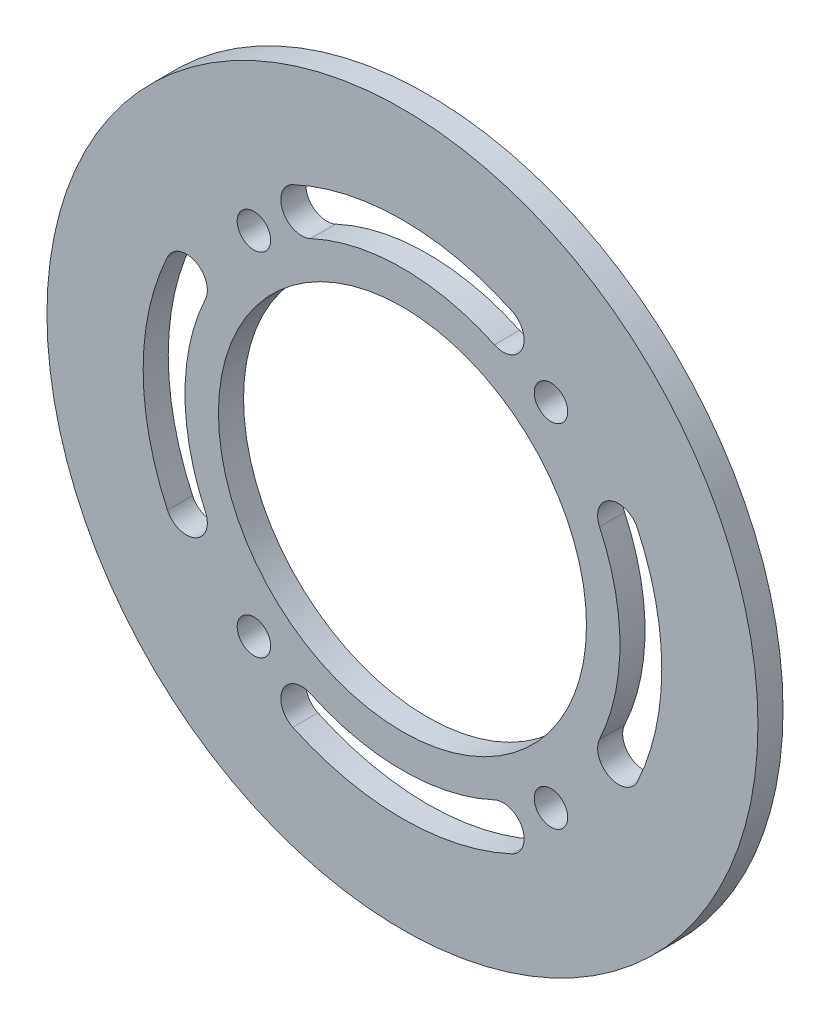
from build123d import *

# Parameters (mm, degrees)
SKETCH_1_R          = 24
SKETCH_1_R_2        = 22
EXTRUDE_1_DEPTH     = 20
SKETCH_2_R          = 42.5
SKETCH_2_R_2        = 22
EXTRUDE_2_DEPTH     = 3
CUT_EXTRUDE_3_DEPTH = 5
SKETCH_12_R         = 24
CUT_EXTRUDE_4_DEPTH = 20
SKETCH_13_R         = 2
CUT_EXTRUDE_7_DEPTH = 30


with BuildPart() as part:
    # 草图1 → 凸台-拉伸1 (new body)
    with BuildSketch(Plane.XY):
        Circle(SKETCH_1_R)
        Circle(SKETCH_1_R_2, mode=Mode.SUBTRACT)
    extrude(amount=EXTRUDE_1_DEPTH)

    # 草图2 → 凸台-拉伸2 (add)
    with BuildSketch(Plane.XY.offset(20)):
        Circle(SKETCH_2_R)
        Circle(SKETCH_2_R_2, mode=Mode.SUBTRACT)
    extrude(amount=EXTRUDE_2_DEPTH)

    # 草图10 → 切除-拉伸3 (cut, symmetric)
    with BuildSketch(Plane.XY.offset(23)):
        with BuildLine():
            ThreePointArc((28.095541398, -13.101166114), (31, 0), (28.095541398, 13.101166114))
            ThreePointArc((28.095541398, 13.101166114), (24.773226276, 14.310389927), (23.564002463, 10.988074805))
            ThreePointArc((23.564002463, 10.988074805), (26, 0), (23.564002463, -10.988074805))
            ThreePointArc((23.564002463, -10.988074805), (24.773226276, -14.310389927), (28.095541398, -13.101166114))
        make_face()
        with BuildLine():
            ThreePointArc((-13.101166114, -28.095541398), (0, -31), (13.101166114, -28.095541398))
            ThreePointArc((13.101166114, -28.095541398), (14.310389927, -24.773226276), (10.988074805, -23.564002463))
            ThreePointArc((10.988074805, -23.564002463), (0, -26), (-10.988074805, -23.564002463))
            ThreePointArc((-10.988074805, -23.564002463), (-14.310389927, -24.773226276), (-13.101166114, -28.095541398))
        make_face()
        with BuildLine():
            ThreePointArc((-28.095541398, 13.101166114), (-31, 0), (-28.095541398, -13.101166114))
            ThreePointArc((-28.095541398, -13.101166114), (-24.773226276, -14.310389927), (-23.564002463, -10.988074805))
            ThreePointArc((-23.564002463, -10.988074805), (-26, 0), (-23.564002463, 10.988074805))
            ThreePointArc((-23.564002463, 10.988074805), (-24.773226276, 14.310389927), (-28.095541398, 13.101166114))
        make_face()
        with BuildLine():
            ThreePointArc((13.101166114, 28.095541398), (0, 31), (-13.101166114, 28.095541398))
            ThreePointArc((-13.101166114, 28.095541398), (-14.310389927, 24.773226276), (-10.988074805, 23.564002463))
            ThreePointArc((-10.988074805, 23.564002463), (0, 26), (10.988074805, 23.564002463))
            ThreePointArc((10.988074805, 23.564002463), (14.310389927, 24.773226276), (13.101166114, 28.095541398))
        make_face()
    extrude(amount=CUT_EXTRUDE_3_DEPTH, both=True, mode=Mode.SUBTRACT)

    # 草图12 → 切除-拉伸4 (cut)
    with BuildSketch(Plane(origin=(0, 0, 0), x_dir=(-1, 0, 0), z_dir=(0, 0, -1))):
        Circle(SKETCH_12_R)
    extrude(amount=-CUT_EXTRUDE_4_DEPTH, mode=Mode.SUBTRACT)

    # 草图13 → 切除-拉伸7 (cut)
    with BuildSketch(Plane.XY):
        with Locations((17.755280905, -21)):
            Circle(SKETCH_13_R)
        with Locations((-17.755280905, -21)):
            Circle(SKETCH_13_R)
        with Locations((17.755280905, 21)):
            Circle(SKETCH_13_R)
        with Locations((-17.755280905, 21)):
            Circle(SKETCH_13_R)
    extrude(amount=CUT_EXTRUDE_7_DEPTH, mode=Mode.SUBTRACT)


solid = part.part
